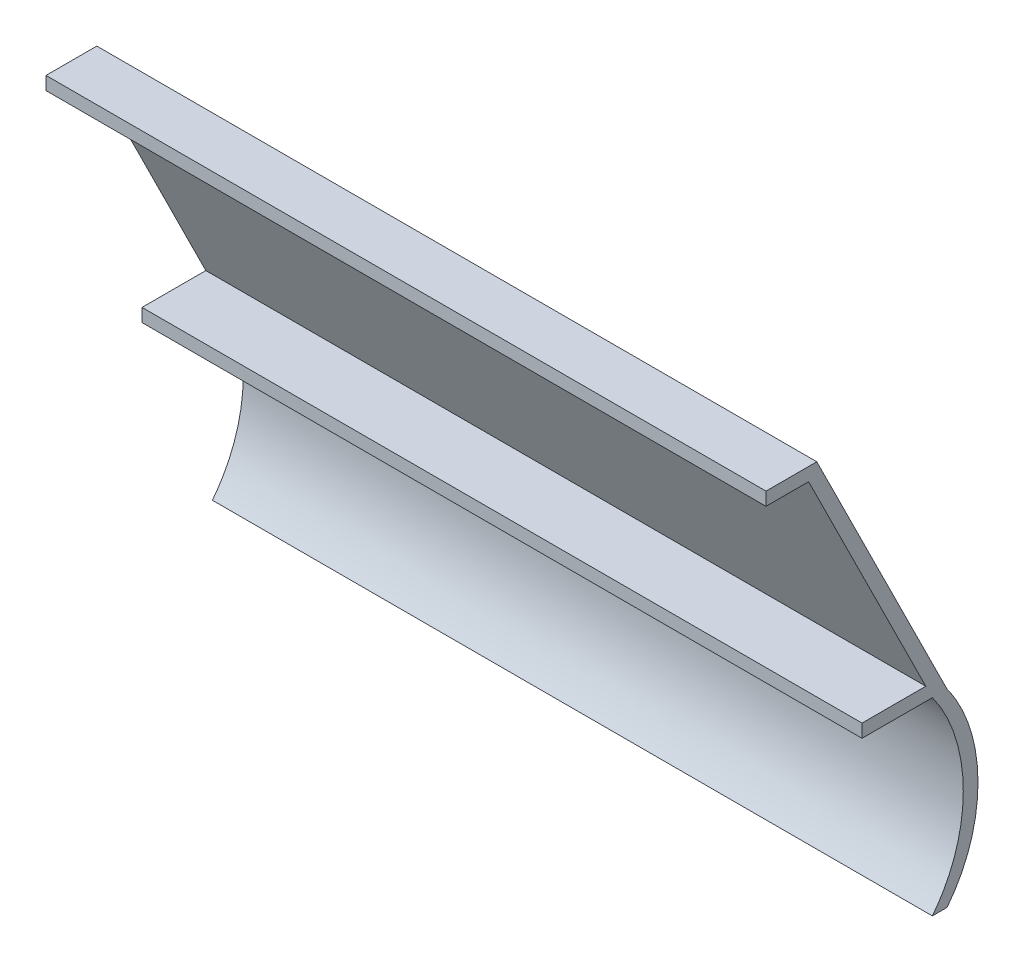
from build123d import *

# Parameters (mm, degrees)
EXTRUDE_1_DEPTH = 163.8


with BuildPart() as part:
    # 草图1 → 凸台-拉伸1 (new body)
    with BuildSketch(Plane(origin=(0, 0, 0), x_dir=(0, 0, -1), z_dir=(1, 0, 0))):
        with BuildLine():
            Line((9.7, 0), (36.35874095, -53.63))
            Line((36.35874095, -53.63), (21.85, -53.63))
            Line((21.85, -53.63), (21.85, -56.63))
            Line((21.85, -56.63), (37.85, -56.63))
            add(Edge.make_bspline(
                [(37.85, -56.63), (46.953982553, -69.060712167), (47.499791502, -87.422152902), (37.85, -99.63)],
                knots=[0, 0, 0, 0, 1, 1, 1, 1], degree=3))
            Line((37.85, -99.63), (41.200202017, -99.63))
            add(Edge.make_bspline(
                [(41.200202017, -56.63), (50.30418457, -69.060712167), (50.849993519, -87.422152902), (41.200202017, -99.63)],
                knots=[0, 0, 0, 0, 1, 1, 1, 1], degree=3))
            Line((41.200202017, -56.63), (41.042940367, -56.313633136))
            Line((41.042940367, -56.313633136), (12.892940367, 0.316366864))
            Line((12.892940367, 0.316366864), (11.558942967, 3))
            Line((11.558942967, 3), (0, 3))
            Line((0, 3), (0, 0))
            Line((0, 0), (9.7, 0))
        make_face()
    extrude(amount=EXTRUDE_1_DEPTH)


solid = part.part
